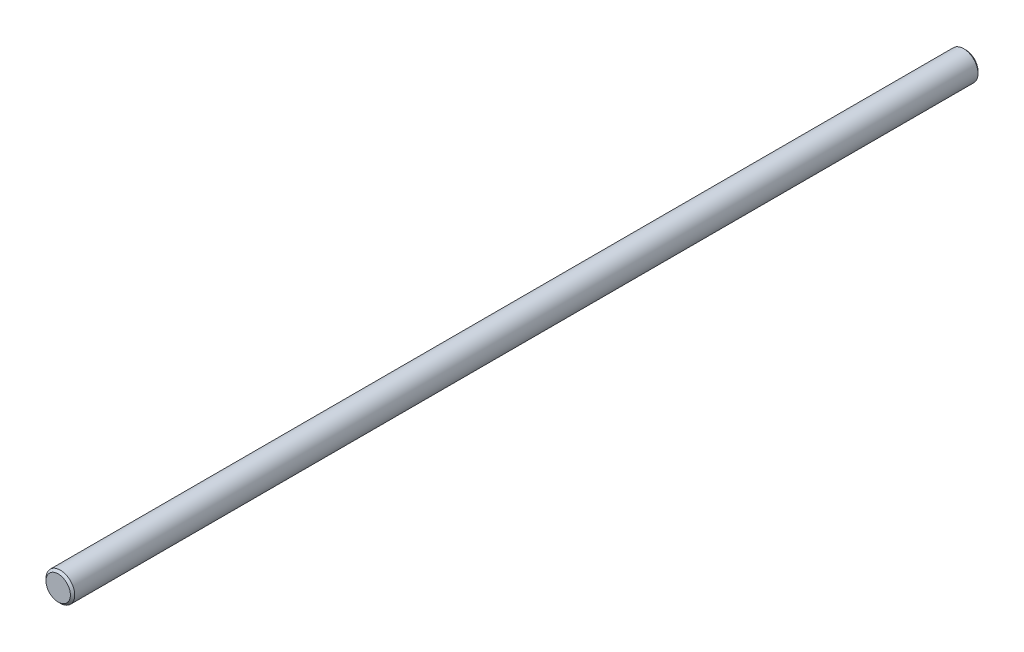
from build123d import *

# Parameters (mm, degrees)
BOSS_EXTRUDE1_DEPTH      = 76.2
BOSS_EXTRUDE1_DEPTH_BACK = 76.2
SKETCH2_R                = 2.413
CHAMFER1_SIZE            = 0.36195


with BuildPart() as part:
    # Sketch2 → Boss-Extrude1 (new, two sides: drawn at the far end of the back side and taken through both)
    with BuildSketch(Plane.XY.offset(-BOSS_EXTRUDE1_DEPTH_BACK)):
        Circle(SKETCH2_R)
    extrude(amount=BOSS_EXTRUDE1_DEPTH + BOSS_EXTRUDE1_DEPTH_BACK)

    # Chamfer1
    chamfer1_edges = [part.edges().sort_by_distance(p)[0] for p in [
        (-2.413, 0, -76.2),
        (-2.413, 0, 76.2),
    ]]
    chamfer(chamfer1_edges, length=CHAMFER1_SIZE)


solid = part.part
